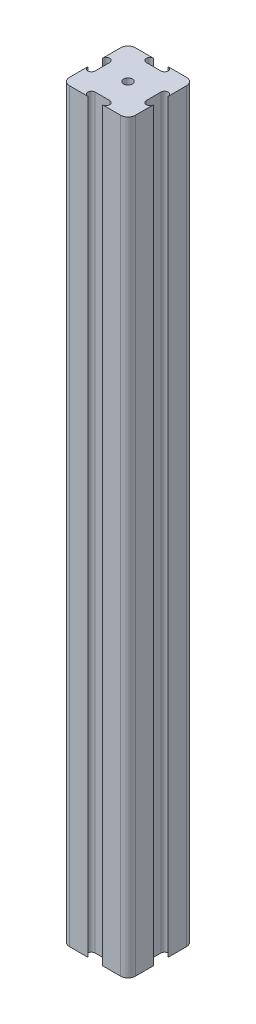
from build123d import *

# Parameters (mm, degrees)
BOSS_EXTRU_2_DEPTH      = 510
ESQUISSE5_R             = 3
ENL_V_MAT_EXTRU_1_DEPTH = 511.991682907


with BuildPart() as part:
    # Esquisse4 → Boss.-Extru.2 (new body)
    with BuildSketch(Plane(origin=(0, 0, 0), x_dir=(1, 0, 0), z_dir=(0, 1, 0))):
        with BuildLine():
            Line((-17.5, 22.5), (-5, 22.5))
            ThreePointArc((-5, 22.5), (-7.5, 20), (-5, 17.5))
            Line((-5, 17.5), (5, 17.5))
            ThreePointArc((5, 17.5), (7.5, 20), (5, 22.5))
            Line((5, 22.5), (17.5, 22.5))
            ThreePointArc((17.5, 22.5), (21.035534799, 21.035533013), (22.5, 17.499997475))
            Line((22.5, 17.499997475), (22.5, 4.999997475))
            ThreePointArc((22.5, 4.999997475), (20, 7.499997475), (17.5, 4.999997475))
            Line((17.5, 4.999997475), (17.5, -5.000002525))
            ThreePointArc((17.5, -5.000002525), (20, -7.500002525), (22.5, -5.000002525))
            Line((22.5, -5.000002525), (22.5, -17.500002525))
            ThreePointArc((22.5, -17.500002525), (21.035533013, -21.035534799), (17.5, -22.5))
            Line((17.5, -22.5), (5, -22.5))
            ThreePointArc((5, -22.5), (7.5, -20), (5, -17.5))
            Line((5, -17.5), (-5, -17.5))
            ThreePointArc((-5, -17.5), (-7.5, -20), (-5, -22.5))
            Line((-5, -22.5), (-17.5, -22.5))
            ThreePointArc((-17.5, -22.5), (-21.035533906, -21.035533906), (-22.5, -17.5))
            Line((-22.5, -17.5), (-22.5, -5))
            ThreePointArc((-22.5, -5), (-20, -7.5), (-17.5, -5))
            Line((-17.5, -5), (-17.5, 5))
            ThreePointArc((-17.5, 5), (-20, 7.5), (-22.5, 5))
            Line((-22.5, 5), (-22.5, 17.5))
            ThreePointArc((-22.5, 17.5), (-21.035533906, 21.035533906), (-17.5, 22.5))
        make_face()
    extrude(amount=BOSS_EXTRU_2_DEPTH)

    # Esquisse5 → Enlèv. mat.-Extru.1 (cut, through all)
    with BuildSketch(Plane.XZ):
        with Locations(Location((0, 0, 0), (0, 0, 270))):
            Circle(ESQUISSE5_R)
    extrude(amount=-ENL_V_MAT_EXTRU_1_DEPTH, mode=Mode.SUBTRACT)


solid = part.part
